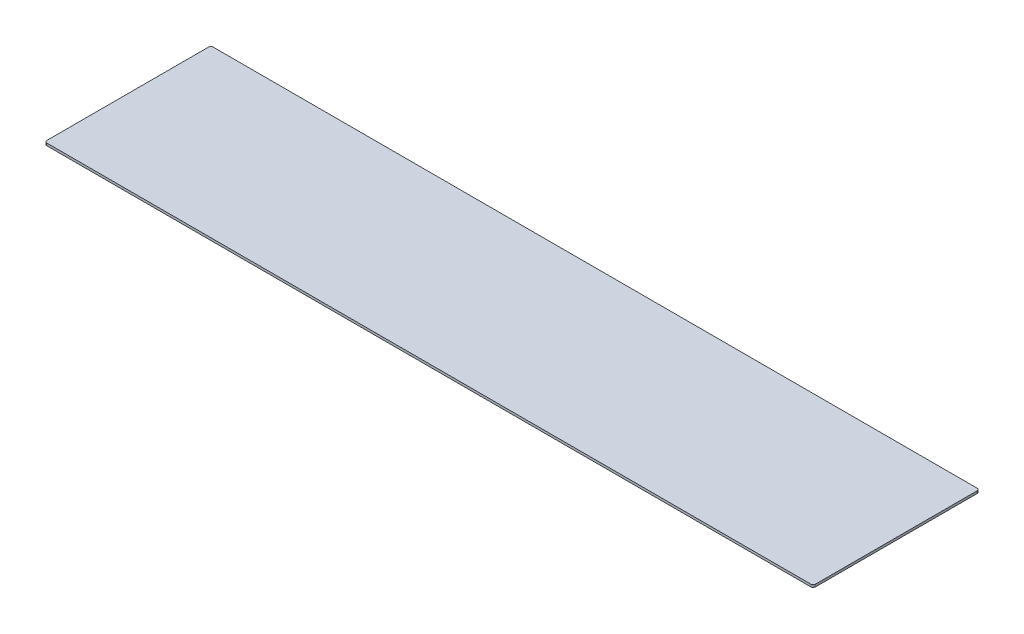
from build123d import *

# Parameters (mm, degrees)
CROQUIS1_W     = 3190
CROQUIS1_H     = 690
EXTRUIR1_DEPTH = 10
REDONDEO1_R    = 10


with BuildPart() as part:
    # Croquis1 → Extruir1 (new body)
    with BuildSketch(Plane(origin=(0, 0, 0), x_dir=(1, 0, 0), z_dir=(0, 1, 0))):
        Rectangle(CROQUIS1_W, CROQUIS1_H)
    extrude(amount=EXTRUIR1_DEPTH)

    # Redondeo1
    redondeo1_edges = [part.edges().sort_by_distance(p)[0] for p in [
        (-1595, 5, -345),
        (1595, 5, -345),
        (1595, 5, 345),
        (-1595, 5, 345),
    ]]
    fillet(redondeo1_edges, radius=REDONDEO1_R)


solid = part.part
